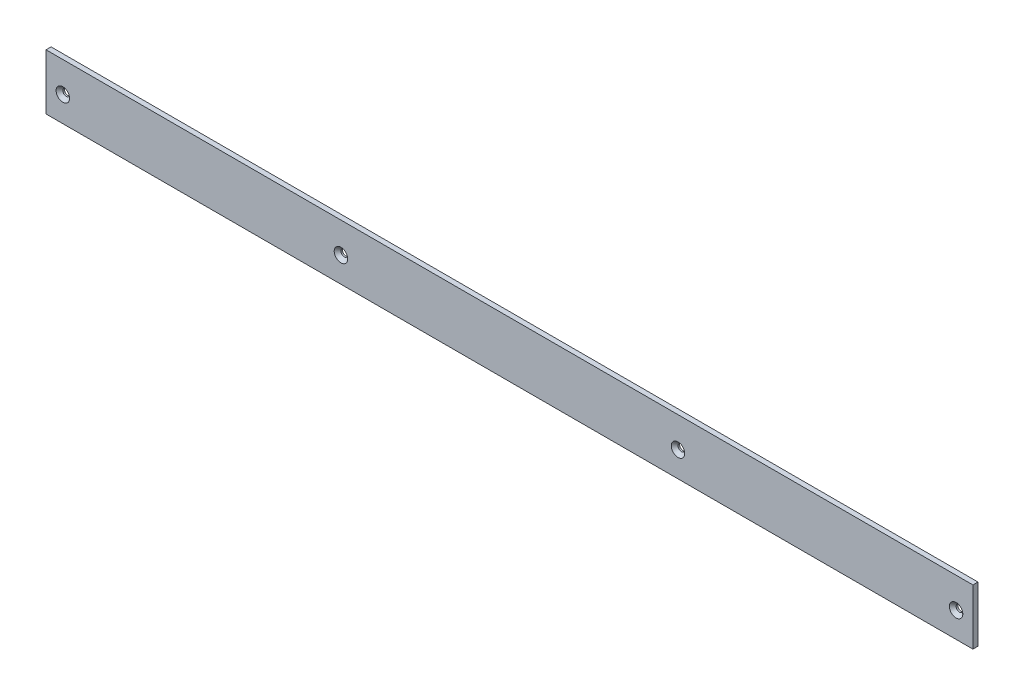
from build123d import *

# Parameters (mm, degrees)
SKETCH_1_W          = 550
SKETCH_1_H          = 33
EXTRUDE_1_DEPTH     = 3
SKETCH_2_R          = 2
CUT_EXTRUDE_2_DEPTH = 276.510889077
CHAMFER_1_SIZE      = 2


with BuildPart() as part:
    # 草图1 → 凸台-拉伸1 (new body)
    with BuildSketch(Plane.XY):
        Rectangle(SKETCH_1_W, SKETCH_1_H)
    extrude(amount=EXTRUDE_1_DEPTH)

    # 草图2 → 切除-拉伸2 (cut, through all)
    with BuildSketch(Plane.XY):
        with Locations((-265, -1.5)):
            Circle(SKETCH_2_R)
        with Locations((-100, -1.5)):
            Circle(SKETCH_2_R)
        with Locations(Location((100, -1.5, 0), (0, 0, 180))):
            Circle(SKETCH_2_R)
        with Locations(Location((265, -1.5, 0), (0, 0, 180))):
            Circle(SKETCH_2_R)
    extrude(amount=CUT_EXTRUDE_2_DEPTH, mode=Mode.SUBTRACT)

    # 倒角1
    chamfer_1_edges = [part.edges().sort_by_distance(p)[0] for p in [
        (-267, -1.5, 3),
        (-102, -1.5, 3),
        (102, -1.5, 3),
        (267, -1.5, 3),
    ]]
    chamfer(chamfer_1_edges, length=CHAMFER_1_SIZE)


solid = part.part
